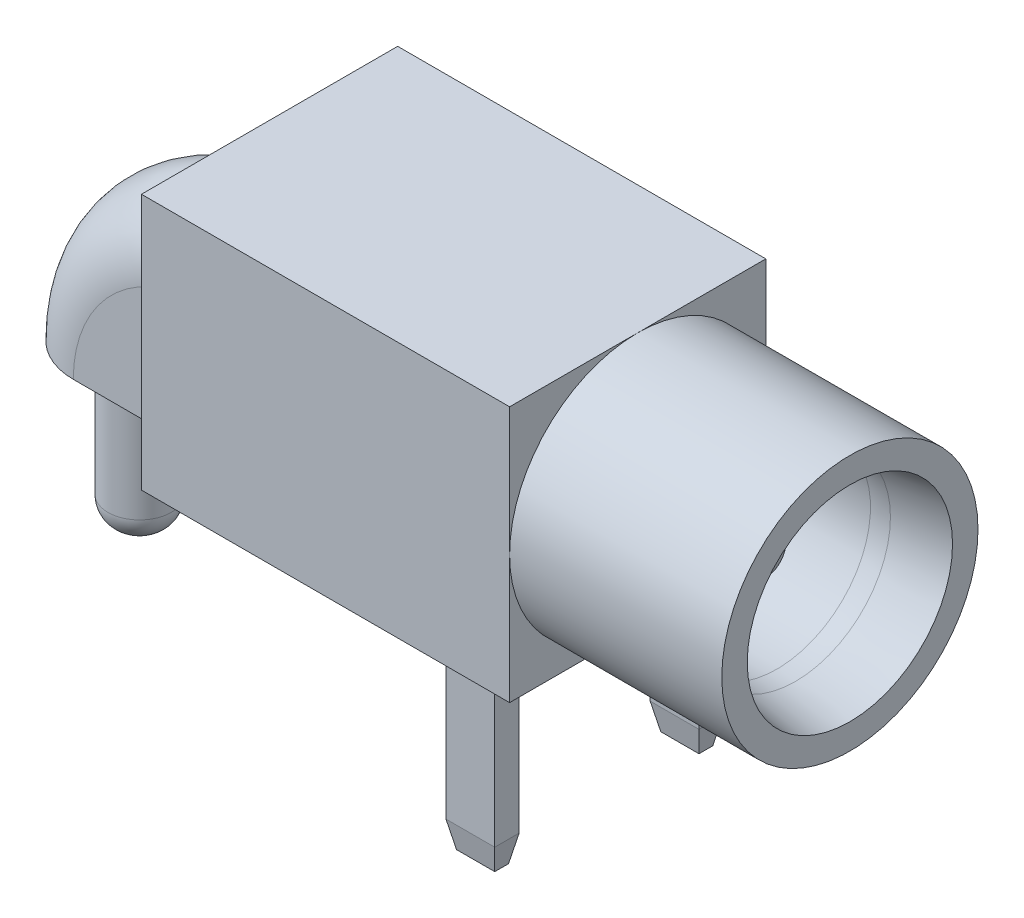
from build123d import *
from OCP.BRepFilletAPI import BRepFilletAPI_MakeChamfer

# Parameters (mm, degrees)
SKETCH1_W             = 8.8138
SKETCH1_H             = 6.1341
BOSS_EXTRUDE1_DEPTH   = 6.1341
SKETCH2_R             = 3.06705
SKETCH2_R_2           = 2.24155
BOSS_EXTRUDE2_DEPTH   = 5.08
REVOLVE1_ANGLE        = 90
CUT_EXTRUDE1_START    = -7.0612
SKETCH6_R             = 2.24155
CUT_EXTRUDE1_DEPTH    = 7.0612
SKETCH11_R            = 1.27
BOSS_EXTRUDE6_DEPTH   = 0.0254
CHAMFER3_SIZE         = 0.2159
CHAMFER3_SIZE2        = 1.524
FILLET4_R             = 3.175
SKETCH7_R             = 0.75565
BOSS_EXTRUDE3_DEPTH   = 10.2362
FILLET3_R             = 0.635
SKETCH8_R             = 0.75565
BOSS_EXTRUDE4_DEPTH   = 3.81
FILLET2_R             = 0.635
SKETCH10_W            = 1.1684
SKETCH10_H            = 0.5842
BOSS_EXTRUDE5_DEPTH   = 4.1402
BOSS_EXTRUDE5_2_DEPTH = 4.1402
CHAMFER1_SIZE         = 0.635
CHAMFER1_SIZE2        = 0.127
CHAMFER2_SIZE         = 0.635
CHAMFER2_SIZE2        = 0.127


with BuildPart() as part:
    # Sketch1 → Boss-Extrude1 (new body)
    with BuildSketch(Plane(origin=(0, 0, 0), x_dir=(1, 0, 0), z_dir=(0, 1, 0))):
        with Locations((4.4069, 3.06705)):
            Rectangle(SKETCH1_W, SKETCH1_H)
    extrude(amount=BOSS_EXTRUDE1_DEPTH)

    # Sketch2 → Boss-Extrude2 (add)
    with BuildSketch(Plane(origin=(8.8138, 0, 0), x_dir=(0, 0, -1), z_dir=(1, 0, 0))):
        with Locations((3.06705, 3.06705)):
            Circle(SKETCH2_R)
        with Locations((3.06705, 3.06705)):
            Circle(SKETCH2_R_2, mode=Mode.SUBTRACT)
    extrude(amount=BOSS_EXTRUDE2_DEPTH)

    # Sketch3 → Revolve1 (revolve)
    with BuildSketch(Plane.ZY):
        with BuildLine():
            Line((-4.65455, 3.1115), (-4.65455, 0))
            Line((-4.65455, 0), (-1.47955, 0))
            Line((-1.47955, 0), (-1.47955, 3.1115))
            ThreePointArc((-1.47955, 3.1115), (-3.06705, 4.699), (-4.65455, 3.1115))
        make_face()
    revolve(axis=Axis((0, 0, 0), (0, 0, 1)), revolution_arc=REVOLVE1_ANGLE)

    # Sketch6 → Cut-Extrude1 (cut)
    with BuildSketch(Plane(origin=(8.8138, 0, 0), x_dir=(0, 0, -1), z_dir=(1, 0, 0)).offset(CUT_EXTRUDE1_START)):
        with Locations((3.06705, 3.06705)):
            Circle(SKETCH6_R)
    extrude(amount=CUT_EXTRUDE1_DEPTH, mode=Mode.SUBTRACT)

    # Sketch11 → Boss-Extrude6 (add)
    with BuildSketch(Plane(origin=(1.7526, 0, 0), x_dir=(0, 0, -1), z_dir=(1, 0, 0))):
        with Locations((3.06705, 3.06705)):
            Circle(SKETCH11_R)
    extrude(amount=BOSS_EXTRUDE6_DEPTH)

    # Chamfer3
    chamfer3_edges = [part.edges().sort_by_distance(p)[0] for p in [
        (13.8938, 3.06705, -0.8255),
    ]]
    chamfer3_side = [part.faces().sort_by_distance(p)[0] for p in [
        (13.8938, 3.06705, -0.086749274),
    ]]
    chamfer(chamfer3_edges, length=CHAMFER3_SIZE, length2=CHAMFER3_SIZE2, reference=chamfer3_side[0])

    # Fillet4
    fillet4_edges = [part.edges().sort_by_distance(p)[0] for p in [
        (12.3698, 3.06705, -0.8255),
    ]]
    fillet(fillet4_edges, radius=FILLET4_R)


with BuildPart() as body_2:
    # Sketch7 → Boss-Extrude3 (new body)
    with BuildSketch(Plane(origin=(1.7526, 0, 0), x_dir=(0, 0, -1), z_dir=(1, 0, 0))):
        with Locations((3.06705, 3.06705)):
            Circle(SKETCH7_R)
    extrude(amount=BOSS_EXTRUDE3_DEPTH)

    # Fillet3
    fillet3_edges = [body_2.edges().sort_by_distance(p)[0] for p in [
        (11.9888, 3.06705, -2.3114),
    ]]
    fillet(fillet3_edges, radius=FILLET3_R)


with BuildPart() as body_3:
    # Sketch8 → Boss-Extrude4 (new body)
    with BuildSketch(Plane.XZ):
        with Locations(Location((-3.1115, -3.06705, 0), (0, 0, 90))):
            Circle(SKETCH8_R)
    extrude(amount=BOSS_EXTRUDE4_DEPTH)

    # Fillet2
    fillet2_edges = [body_3.edges().sort_by_distance(p)[0] for p in [
        (-3.1115, -3.81, -3.8227),
    ]]
    fillet(fillet2_edges, radius=FILLET2_R)


with BuildPart() as body_4:
    # Sketch10 → Boss-Extrude5 (new body)
    with BuildSketch(Plane.XZ):
        with Locations((7.5438, -0.6223)):
            Rectangle(SKETCH10_W, SKETCH10_H)
    extrude(amount=BOSS_EXTRUDE5_DEPTH)

    # Chamfer1: one chamfer whose edges measure the first distance from different faces: ONE call of the kernel's chamfer builder (chamfer() names one face for all edges)
    chamfer1_edges_1 = [body_4.edges().sort_by_distance(p)[0] for p in [
        (6.9596, -4.1402, -0.6223),
    ]]
    chamfer1_side_1 = [body_4.faces().sort_by_distance(p)[0] for p in [
        (6.9596, -2.0701, -0.6223),
    ]]
    chamfer1_edges_2 = [body_4.edges().sort_by_distance(p)[0] for p in [
        (7.5438, -4.1402, -0.9144),
    ]]
    chamfer1_side_2 = [body_4.faces().sort_by_distance(p)[0] for p in [
        (7.5438, -2.0701, -0.9144),
    ]]
    chamfer1_edges_3 = [body_4.edges().sort_by_distance(p)[0] for p in [
        (8.128, -4.1402, -0.6223),
    ]]
    chamfer1_side_3 = [body_4.faces().sort_by_distance(p)[0] for p in [
        (8.128, -2.0701, -0.6223),
    ]]
    chamfer1_edges_4 = [body_4.edges().sort_by_distance(p)[0] for p in [
        (7.5438, -4.1402, -0.3302),
    ]]
    chamfer1_side_4 = [body_4.faces().sort_by_distance(p)[0] for p in [
        (7.5438, -2.0701, -0.3302),
    ]]
    chamfer1 = BRepFilletAPI_MakeChamfer(body_4.part.solid().wrapped)
    for e in chamfer1_edges_1:
        chamfer1.Add(CHAMFER1_SIZE, CHAMFER1_SIZE2, e.wrapped, chamfer1_side_1[0].wrapped)  # the first distance lies on this face
    for e in chamfer1_edges_2:
        chamfer1.Add(CHAMFER1_SIZE, CHAMFER1_SIZE2, e.wrapped, chamfer1_side_2[0].wrapped)  # the first distance lies on this face
    for e in chamfer1_edges_3:
        chamfer1.Add(CHAMFER1_SIZE, CHAMFER1_SIZE2, e.wrapped, chamfer1_side_3[0].wrapped)  # the first distance lies on this face
    for e in chamfer1_edges_4:
        chamfer1.Add(CHAMFER1_SIZE, CHAMFER1_SIZE2, e.wrapped, chamfer1_side_4[0].wrapped)  # the first distance lies on this face
    add(Compound.cast(chamfer1.Shape()), mode=Mode.REPLACE)


with BuildPart() as body_5:
    # Sketch10 → Boss-Extrude5 2 (new body)
    with BuildSketch(Plane.XZ):
        with Locations((7.5438, -5.5118)):
            Rectangle(SKETCH10_W, SKETCH10_H)
    extrude(amount=BOSS_EXTRUDE5_2_DEPTH)

    # Chamfer2: one chamfer whose edges measure the first distance from different faces: ONE call of the kernel's chamfer builder (chamfer() names one face for all edges)
    chamfer2_edges_1 = [body_5.edges().sort_by_distance(p)[0] for p in [
        (6.9596, -4.1402, -5.5118),
    ]]
    chamfer2_side_1 = [body_5.faces().sort_by_distance(p)[0] for p in [
        (6.9596, -2.0701, -5.5118),
    ]]
    chamfer2_edges_2 = [body_5.edges().sort_by_distance(p)[0] for p in [
        (7.5438, -4.1402, -5.8039),
    ]]
    chamfer2_side_2 = [body_5.faces().sort_by_distance(p)[0] for p in [
        (7.5438, -2.0701, -5.8039),
    ]]
    chamfer2_edges_3 = [body_5.edges().sort_by_distance(p)[0] for p in [
        (8.128, -4.1402, -5.5118),
    ]]
    chamfer2_side_3 = [body_5.faces().sort_by_distance(p)[0] for p in [
        (8.128, -2.0701, -5.5118),
    ]]
    chamfer2_edges_4 = [body_5.edges().sort_by_distance(p)[0] for p in [
        (7.5438, -4.1402, -5.2197),
    ]]
    chamfer2_side_4 = [body_5.faces().sort_by_distance(p)[0] for p in [
        (7.5438, -2.0701, -5.2197),
    ]]
    chamfer2 = BRepFilletAPI_MakeChamfer(body_5.part.solid().wrapped)
    for e in chamfer2_edges_1:
        chamfer2.Add(CHAMFER2_SIZE, CHAMFER2_SIZE2, e.wrapped, chamfer2_side_1[0].wrapped)  # the first distance lies on this face
    for e in chamfer2_edges_2:
        chamfer2.Add(CHAMFER2_SIZE, CHAMFER2_SIZE2, e.wrapped, chamfer2_side_2[0].wrapped)  # the first distance lies on this face
    for e in chamfer2_edges_3:
        chamfer2.Add(CHAMFER2_SIZE, CHAMFER2_SIZE2, e.wrapped, chamfer2_side_3[0].wrapped)  # the first distance lies on this face
    for e in chamfer2_edges_4:
        chamfer2.Add(CHAMFER2_SIZE, CHAMFER2_SIZE2, e.wrapped, chamfer2_side_4[0].wrapped)  # the first distance lies on this face
    add(Compound.cast(chamfer2.Shape()), mode=Mode.REPLACE)


solid = Compound([part.part, body_2.part, body_3.part, body_4.part, body_5.part])
